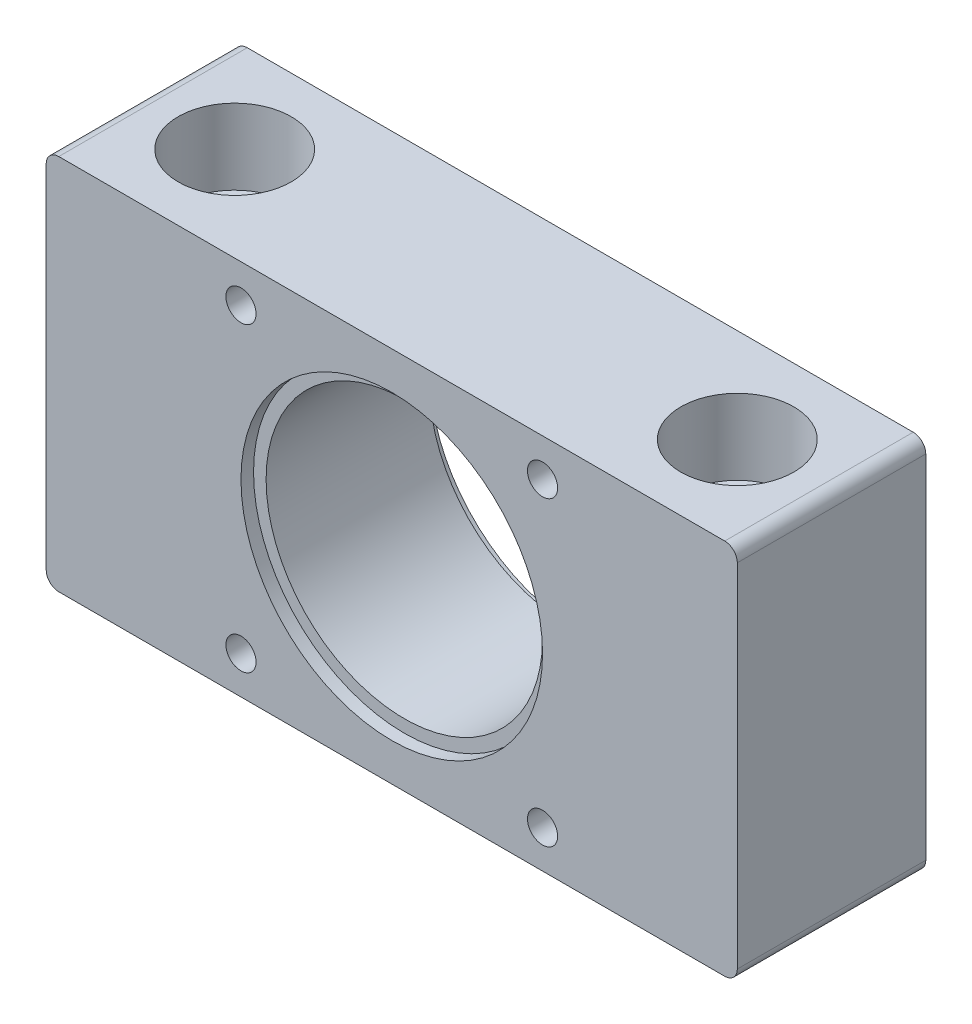
from build123d import *

# Parameters (mm, degrees)
SKETCH_1_W          = 55
SKETCH_1_H          = 30
SKETCH_1_R          = 11
EXTRUDE_1_DEPTH     = 15
SKETCH_2_R          = 2.55
CUT_EXTRUDE_1_DEPTH = 44.373378932
SKETCH_4_R          = 12
CUT_EXTRUDE_3_DEPTH = 1
CUT_EXTRUDE_START   = -1
SKETCH_5_R          = 12
CUT_EXTRUDE_4_DEPTH = 1
SKETCH_6_R          = 1.2
CUT_EXTRUDE_5_DEPTH = 35.731109974
FILLET_2_R          = 1
SKETCH_7_R          = 4.5
CUT_EXTRUDE_6_DEPTH = 6


with BuildPart() as part:
    # 草图1 → 凸台-拉伸1 (new body)
    with BuildSketch(Plane.XY):
        Rectangle(SKETCH_1_W, SKETCH_1_H)
        Circle(SKETCH_1_R, mode=Mode.SUBTRACT)
    extrude(amount=EXTRUDE_1_DEPTH)

    # 草图2 → 切除-拉伸1 (cut, through all)
    with BuildSketch(Plane(origin=(0, 15, 0), x_dir=(1, 0, 0), z_dir=(0, 1, 0))):
        with Locations(Location((-20, -7.5, 0), (0, 0, 270))):
            Circle(SKETCH_2_R)
        with Locations(Location((20, -7.5, 0), (0, 0, 90))):
            Circle(SKETCH_2_R)
    extrude(amount=-CUT_EXTRUDE_1_DEPTH, mode=Mode.SUBTRACT)

    # 草图4 → 切除-拉伸3 (cut)
    with BuildSketch(Plane(origin=(0, 0, 0), x_dir=(-1, 0, 0), z_dir=(0, 0, -1))):
        Circle(SKETCH_4_R)
    extrude(amount=-CUT_EXTRUDE_3_DEPTH, mode=Mode.SUBTRACT)

    # 草图5 → 切除-拉伸4 (cut)
    with BuildSketch(Plane.XY.offset(15).offset(CUT_EXTRUDE_START)):
        with Locations(Location((0, 0, 0), (0, 0, 180))):
            Circle(SKETCH_5_R)
    extrude(amount=CUT_EXTRUDE_4_DEPTH, mode=Mode.SUBTRACT)

    # 草图6 → 切除-拉伸5 (cut, through all)
    with BuildSketch(Plane.XY.offset(15)):
        with Locations((12, 12)):
            Circle(SKETCH_6_R)
        with Locations(Location((-12, 12, 0), (0, 0, 180))):
            Circle(SKETCH_6_R)
        with Locations((-12, -12)):
            Circle(SKETCH_6_R)
        with Locations(Location((12, -12, 0), (0, 0, 180))):
            Circle(SKETCH_6_R)
    extrude(amount=-CUT_EXTRUDE_5_DEPTH, mode=Mode.SUBTRACT)

    # 圆角2
    fillet_2_edges = [part.edges().sort_by_distance(p)[0] for p in [
        (-27.5, 15, 7.5),
        (27.5, 15, 7.5),
        (27.5, -15, 7.5),
        (-27.5, -15, 7.5),
    ]]
    fillet(fillet_2_edges, radius=FILLET_2_R)

    # 草图7 → 切除-拉伸6 (cut)
    with BuildSketch(Plane(origin=(0, 15, 0), x_dir=(1, 0, 0), z_dir=(0, 1, 0))):
        with Locations(Location((-20, -7.5, 0), (0, 0, 270))):
            Circle(SKETCH_7_R)
        with Locations(Location((20, -7.5, 0), (0, 0, 270))):
            Circle(SKETCH_7_R)
    extrude(amount=-CUT_EXTRUDE_6_DEPTH, mode=Mode.SUBTRACT)


solid = part.part
